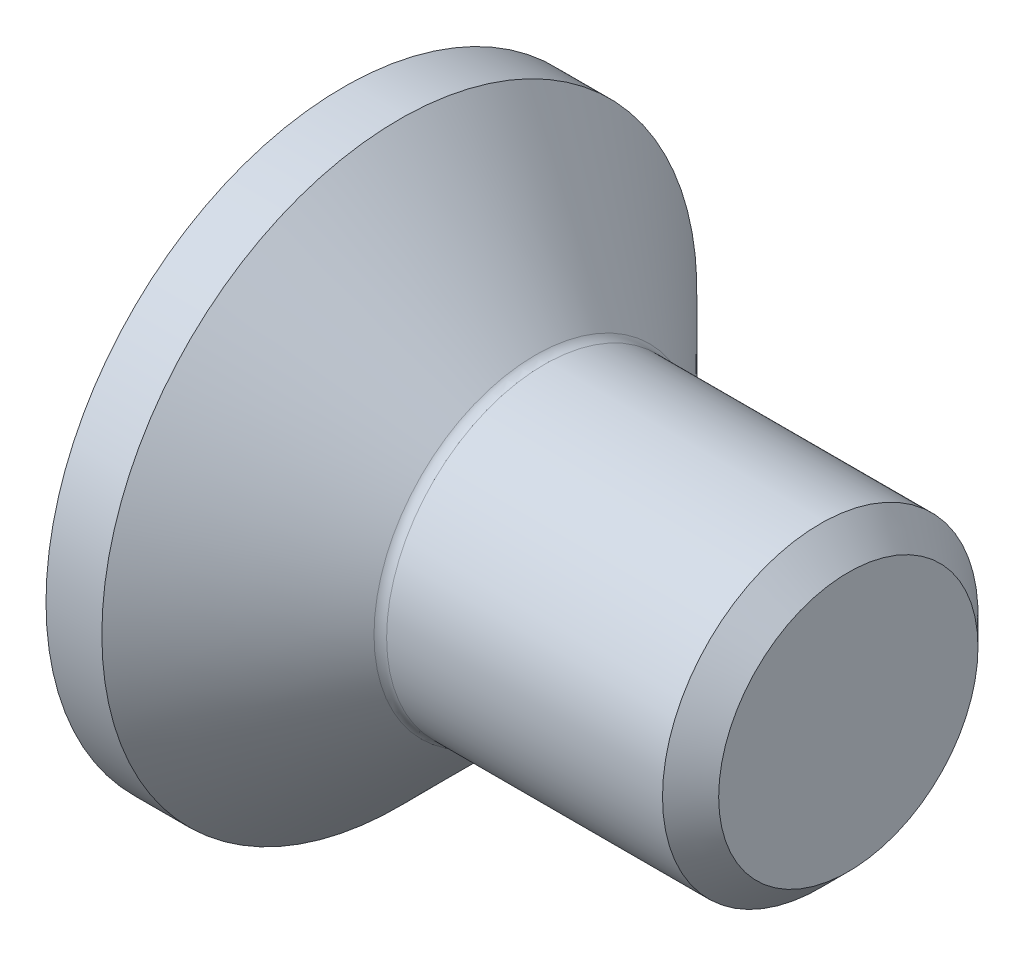
from build123d import *

# Parameters (mm, degrees)
FILLET1_R   = 0.2
HEX_2_DEPTH = 1.9


with BuildPart() as part:
    # BodySke → BaseBody (revolve)
    with BuildSketch(Plane.XY, mode=Mode.PRIVATE) as basebody_sk:
        Polygon((0, 0), (0, 4.715), (0.885, 4.715), (3.1, 2.5), (7.555, 2.5), (8, 2.055), (8, 0), align=None)
    revolve(basebody_sk.sketch.rotate(Axis((0, 0, 0), (1, 0, 0)), 90), axis=Axis((0, 0, 0), (1, 0, 0)))

    # Fillet1
    fillet1_edges = [part.edges().sort_by_distance(p)[0] for p in [
        (3.1, 0, -2.5),
    ]]
    fillet(fillet1_edges, radius=FILLET1_R)

    # Sketch2 → PreBroach (revolve, cut)
    with BuildSketch(Plane.XY, mode=Mode.PRIVATE) as prebroach_sk:
        Polygon((0, 1.5), (1.9, 1.5), (2.766025404, 0), (0, 0), align=None)
    revolve(prebroach_sk.sketch.rotate(Axis((0, 0, 0), (1, 0, 0)), 90), axis=Axis((0, 0, 0), (1, 0, 0)), mode=Mode.SUBTRACT)

    # Sketch3 → Hex 2 (cut)
    with BuildSketch(Plane.ZY):
        Polygon((-1.5, -0.866025404), (-1.5, 0.866025404), (0, 1.732050808), (1.5, 0.866025404), (1.5, -0.866025404), (0, -1.732050808), align=None)
    extrude(amount=-HEX_2_DEPTH, mode=Mode.SUBTRACT)


solid = part.part
